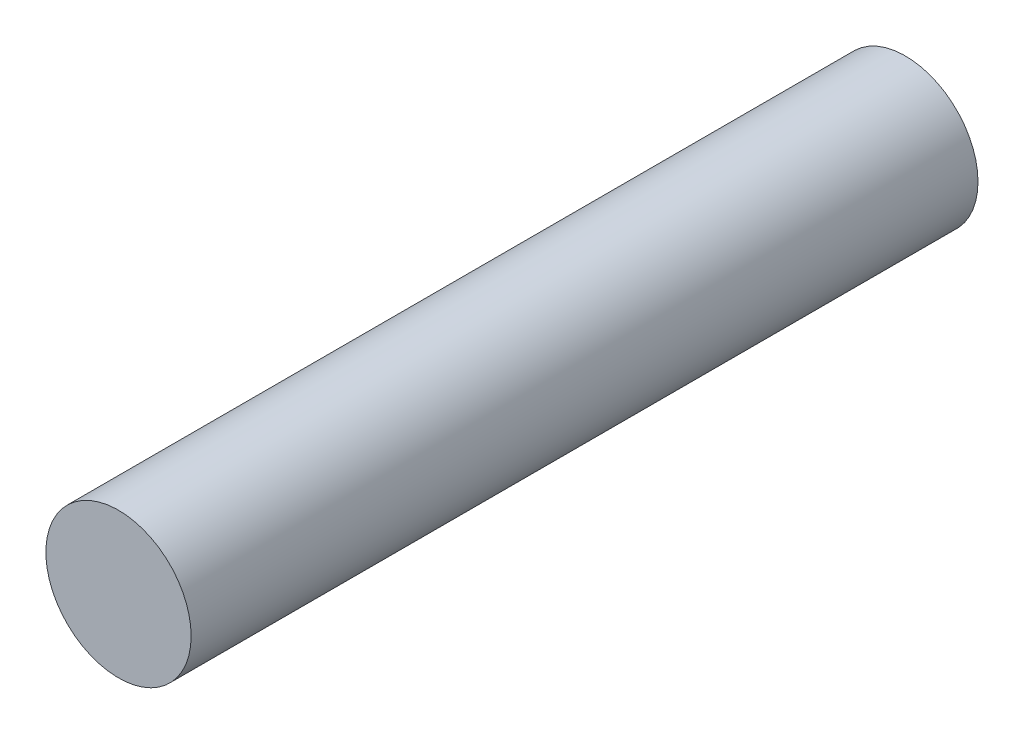
from build123d import *

# Parameters (mm, degrees)
SKETCH2_R           = 6
BOSS_EXTRUDE2_DEPTH = 65


with BuildPart() as part:
    # Sketch2 → Boss-Extrude2 (new body)
    with BuildSketch(Plane.XY):
        Circle(SKETCH2_R)
    extrude(amount=BOSS_EXTRUDE2_DEPTH)


solid = part.part
